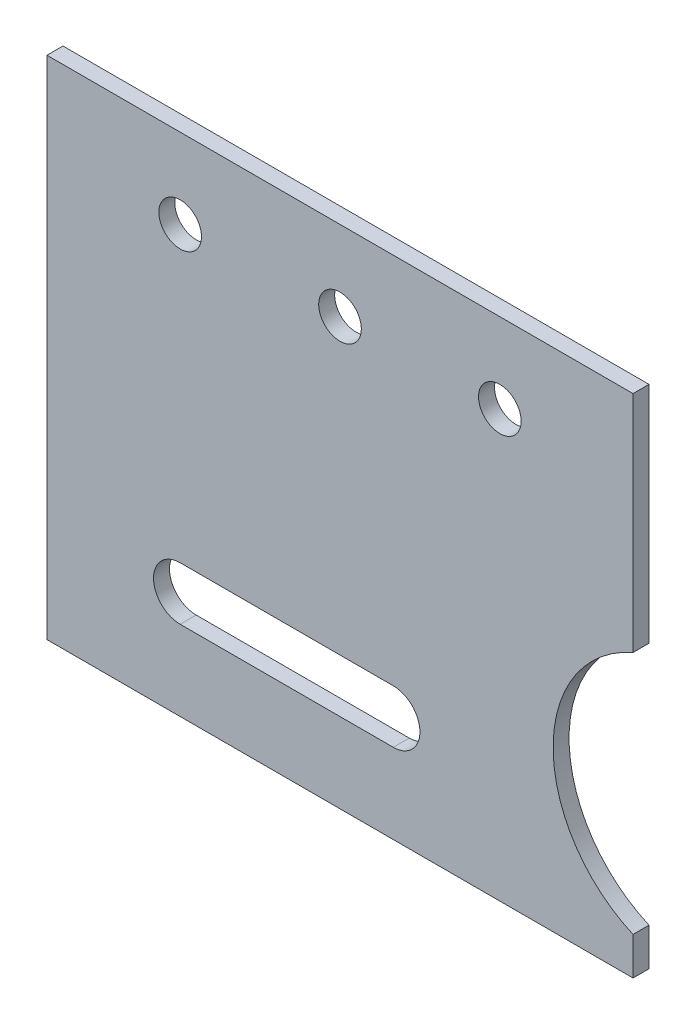
from build123d import *

# Parameters (mm, degrees)
SKIZZE1_R                       = 4
AUFSATZ_LINEAR_AUSTRAGEN1_DEPTH = 3


with BuildPart() as part:
    # Skizze1 → Aufsatz-Linear austragen1 (new body)
    with BuildSketch(Plane.XY):
        with BuildLine():
            Line((0, 0), (110, 0))
            Line((110, 0), (110, 7.087121525))
            ThreePointArc((110, 7.087121525), (95, 30), (110, 52.912878475))
            Line((110, 52.912878475), (110, 95))
            Line((110, 95), (0, 95))
            Line((0, 95), (0, 0))
        make_face()
        with Locations((25, 80)):
            Circle(SKIZZE1_R, mode=Mode.SUBTRACT)
        with Locations((55, 80)):
            Circle(SKIZZE1_R, mode=Mode.SUBTRACT)
        with Locations((85, 80)):
            Circle(SKIZZE1_R, mode=Mode.SUBTRACT)
        with BuildLine():
            Line((25, 25), (65, 25))
            ThreePointArc((65, 25), (70, 20), (65, 15))
            Line((65, 15), (25, 15))
            ThreePointArc((25, 15), (20, 20), (25, 25))
        make_face(mode=Mode.SUBTRACT)
    extrude(amount=AUFSATZ_LINEAR_AUSTRAGEN1_DEPTH)


solid = part.part
